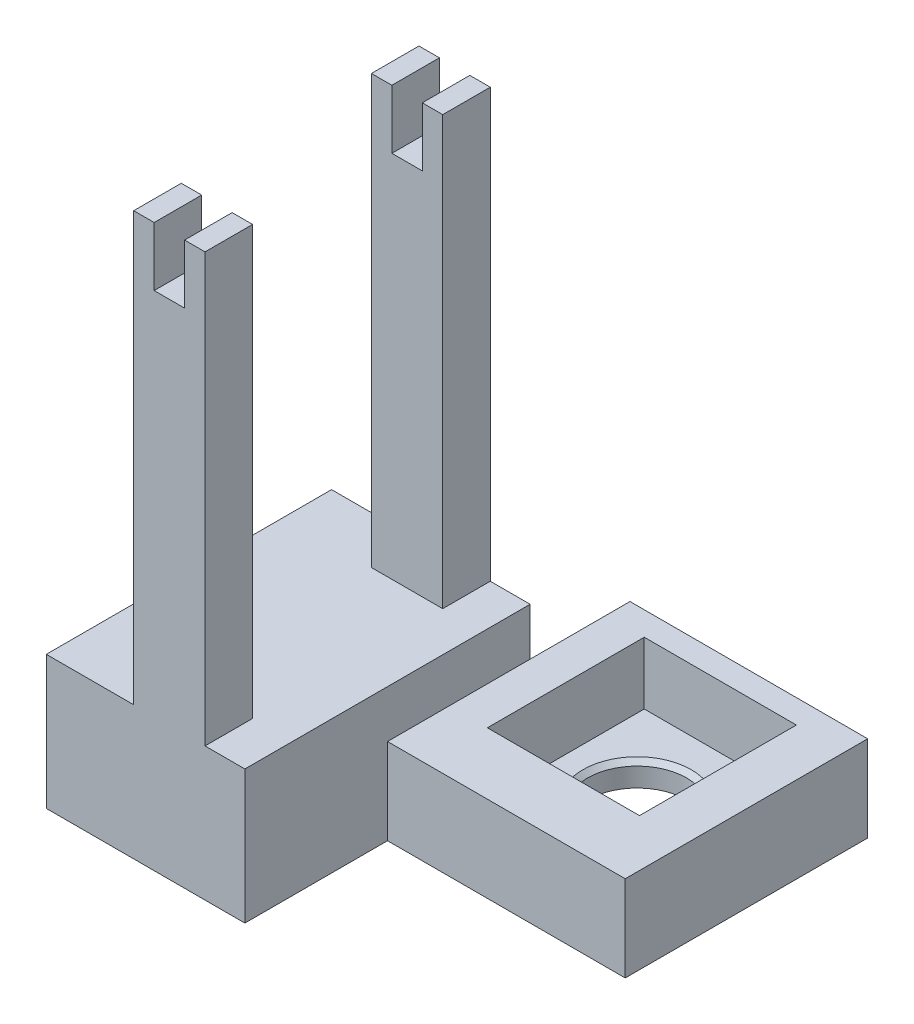
from build123d import *

# Parameters (mm, degrees)
SKETCH2_W           = 41.77
SKETCH2_H           = 60
BOSS_EXTRUDE1_DEPTH = 28.08
SKETCH6_W           = 15
SKETCH6_H           = 10
BOSS_EXTRUDE4_DEPTH = 90
SKETCH7_W           = 6.4
SKETCH7_H           = 12.4
CUT_EXTRUDE1_DEPTH  = 135.955250454
SKETCH8_W           = 51
SKETCH8_H           = 18.08
BOSS_EXTRUDE5_DEPTH = 50
SKETCH9_W           = 33
SKETCH9_H           = 13.08
CUT_EXTRUDE2_DEPTH  = 32
SKETCH10_W          = 35.77
SKETCH10_H          = 54
CUT_EXTRUDE3_DEPTH  = 25.08
SKETCH11_W          = 50
SKETCH11_H          = 9
CUT_EXTRUDE4_DEPTH  = 15.08
SKETCH13_R          = 10.4
CUT_EXTRUDE5_DEPTH  = 10
CHAMFER1_SIZE       = 1


with BuildPart() as part:
    # Sketch2 → Boss-Extrude1 (new body)
    with BuildSketch(Plane(origin=(0, 0, 0), x_dir=(1, 0, 0), z_dir=(0, 1, 0))):
        with Locations((-5, 0)):
            Rectangle(SKETCH2_W, SKETCH2_H)
    extrude(amount=BOSS_EXTRUDE1_DEPTH)

    # Sketch6 → Boss-Extrude4 (add)
    with BuildSketch(Plane(origin=(0, 28.08, 0), x_dir=(1, 0, 0), z_dir=(0, 1, 0))):
        with Locations((0, -25)):
            Rectangle(SKETCH6_W, SKETCH6_H)
        with Locations((0, 25)):
            Rectangle(SKETCH6_W, SKETCH6_H)
    extrude(amount=BOSS_EXTRUDE4_DEPTH)

    # Sketch7 → Cut-Extrude1 (cut, through all)
    with BuildSketch(Plane(origin=(0, 0, -30), x_dir=(-1, 0, 0), z_dir=(0, 0, -1))):
        with Locations((0, 111.88)):
            Rectangle(SKETCH7_W, SKETCH7_H)
    extrude(amount=-CUT_EXTRUDE1_DEPTH, mode=Mode.SUBTRACT)

    # Sketch8 → Boss-Extrude5 (add)
    with BuildSketch(Plane(origin=(15.885, 0, 0), x_dir=(0, 0, -1), z_dir=(1, 0, 0))):
        with Locations((25.5, 9.04)):
            Rectangle(SKETCH8_W, SKETCH8_H)
    extrude(amount=BOSS_EXTRUDE5_DEPTH)

    # Sketch9 → Cut-Extrude2 (cut)
    with BuildSketch(Plane(origin=(55.885, 0, 0), x_dir=(0, 0, -1), z_dir=(1, 0, 0))):
        with Locations((29.5, 11.54)):
            Rectangle(SKETCH9_W, SKETCH9_H)
    extrude(amount=-CUT_EXTRUDE2_DEPTH, mode=Mode.SUBTRACT)

    # Sketch10 → Cut-Extrude3 (cut)
    with BuildSketch(Plane.XZ):
        with Locations((-5, 0)):
            Rectangle(SKETCH10_W, SKETCH10_H)
    extrude(amount=-CUT_EXTRUDE3_DEPTH, mode=Mode.SUBTRACT)

    # Sketch11 → Cut-Extrude4 (cut)
    with BuildSketch(Plane.XZ):
        with Locations((37.885, -7.5)):
            Rectangle(SKETCH11_W, SKETCH11_H)
    extrude(amount=-CUT_EXTRUDE4_DEPTH, mode=Mode.SUBTRACT)

    # Sketch13 → Cut-Extrude5 (cut)
    with BuildSketch(Plane(origin=(0, 5, 0), x_dir=(1, 0, 0), z_dir=(0, 1, 0))):
        with Locations(Location((39.885, 28.5, 0), (0, 0, 270))):
            Circle(SKETCH13_R)
    extrude(amount=-CUT_EXTRUDE5_DEPTH, mode=Mode.SUBTRACT)

    # Chamfer1
    chamfer1_edges = [part.edges().sort_by_distance(p)[0] for p in [
        (39.885, 5, -38.9),
    ]]
    chamfer(chamfer1_edges, length=CHAMFER1_SIZE)


solid = part.part
